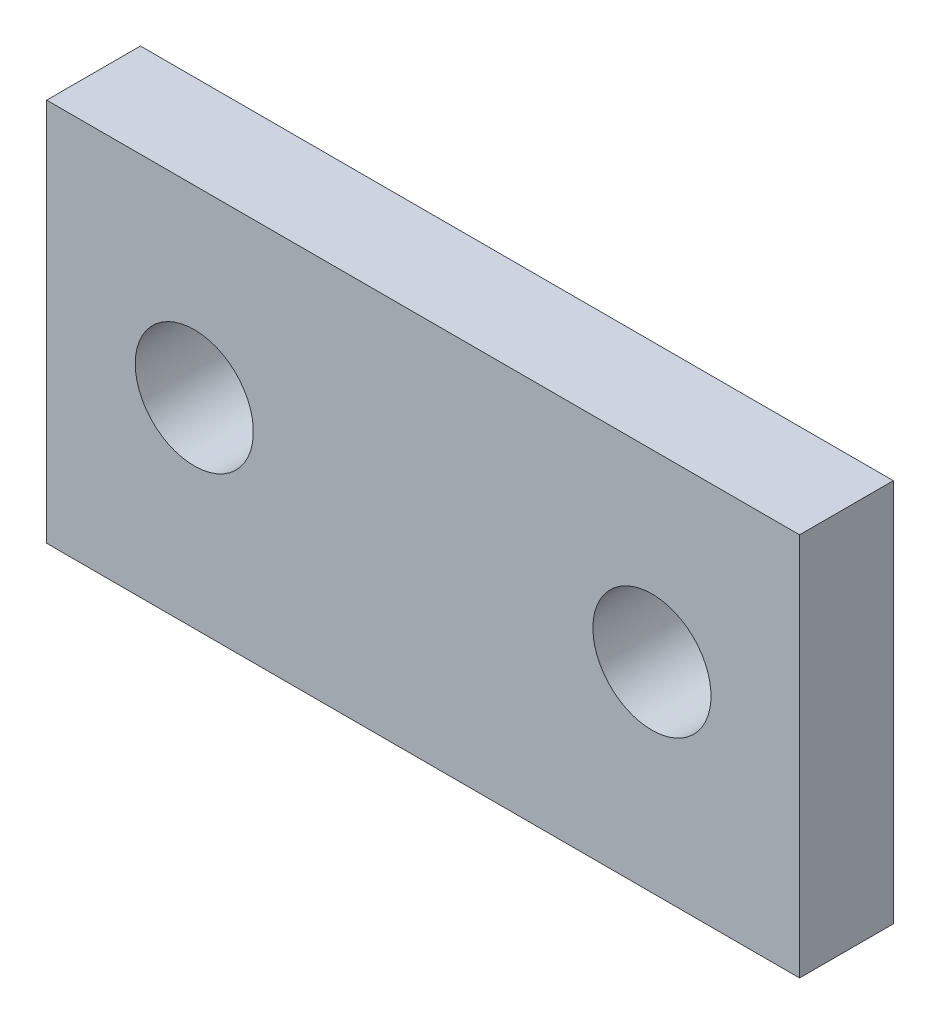
from build123d import *

# Parameters (mm, degrees)
SKETCH1_W           = 25.5
SKETCH1_H           = 13
BOSS_EXTRUDE1_DEPTH = 3.175
SKETCH2_R           = 2
CUT_EXTRUDE1_DEPTH  = 15.788505467


with BuildPart() as part:
    # Sketch1 → Boss-Extrude1 (new body)
    with BuildSketch(Plane.XY):
        with Locations((0.009203008, -0.269195489)):
            Rectangle(SKETCH1_W, SKETCH1_H)
    extrude(amount=BOSS_EXTRUDE1_DEPTH)

    # Sketch2 → Cut-Extrude1 (cut, through all)
    with BuildSketch(Plane(origin=(0, 0, 0), x_dir=(-1, 0, 0), z_dir=(0, 0, -1))):
        with Locations((-7.759203008, 0)):
            Circle(SKETCH2_R)
        with Locations((7.740796992, 0)):
            Circle(SKETCH2_R)
    extrude(amount=-CUT_EXTRUDE1_DEPTH, mode=Mode.SUBTRACT)


solid = part.part
